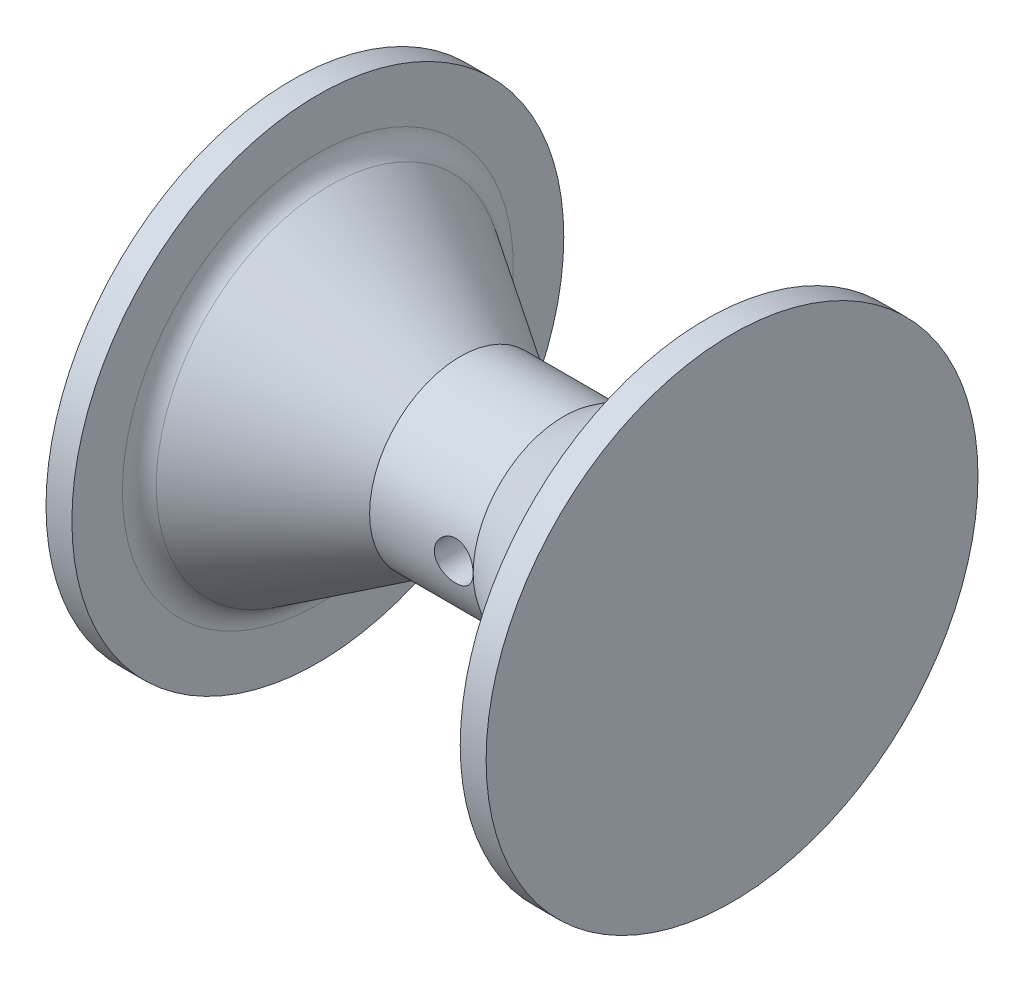
from build123d import *

# Parameters (mm, degrees)
MOTOR_SHAFT_DEPTH  = 13
SKETCH4_R          = 1.5
STRING_HOLES_DEPTH = 17.5
FILLET1_R          = 2


with BuildPart() as part:
    # Sketch2 → Revolve1 (revolve)
    with BuildSketch(Plane.XY, mode=Mode.PRIVATE) as revolve1_sk:
        Polygon((15, 14), (15, 19), (17, 19), (17, 0), (-17, 0), (-17, 19), (-15, 19), (-15, 14), (-4, 7), (4, 7), align=None)
    revolve(revolve1_sk.sketch.rotate(Axis((0, 0, 0), (1, 0, 0)), 90), axis=Axis((0, 0, 0), (1, 0, 0)))

    # Sketch3 → motor shaft (cut)
    with BuildSketch(Plane.ZY.offset(17)):
        with BuildLine():
            Line((2.9, 1.574801575), (2.9, -1.574801575))
            ThreePointArc((2.9, -1.574801575), (-3.3, 0), (2.9, 1.574801575))
        make_face()
    extrude(amount=-MOTOR_SHAFT_DEPTH, mode=Mode.SUBTRACT)

    # Sketch4 → string holes (cut, symmetric)
    with BuildSketch(Plane.XY):
        with Locations((2.5, 0)):
            Circle(SKETCH4_R)
    extrude(amount=STRING_HOLES_DEPTH, both=True, mode=Mode.SUBTRACT)

    # Fillet1
    fillet1_edges = [part.edges().sort_by_distance(p)[0] for p in [
        (15, 0, -14),
        (-15, 0, -14),
    ]]
    fillet(fillet1_edges, radius=FILLET1_R)


solid = part.part
